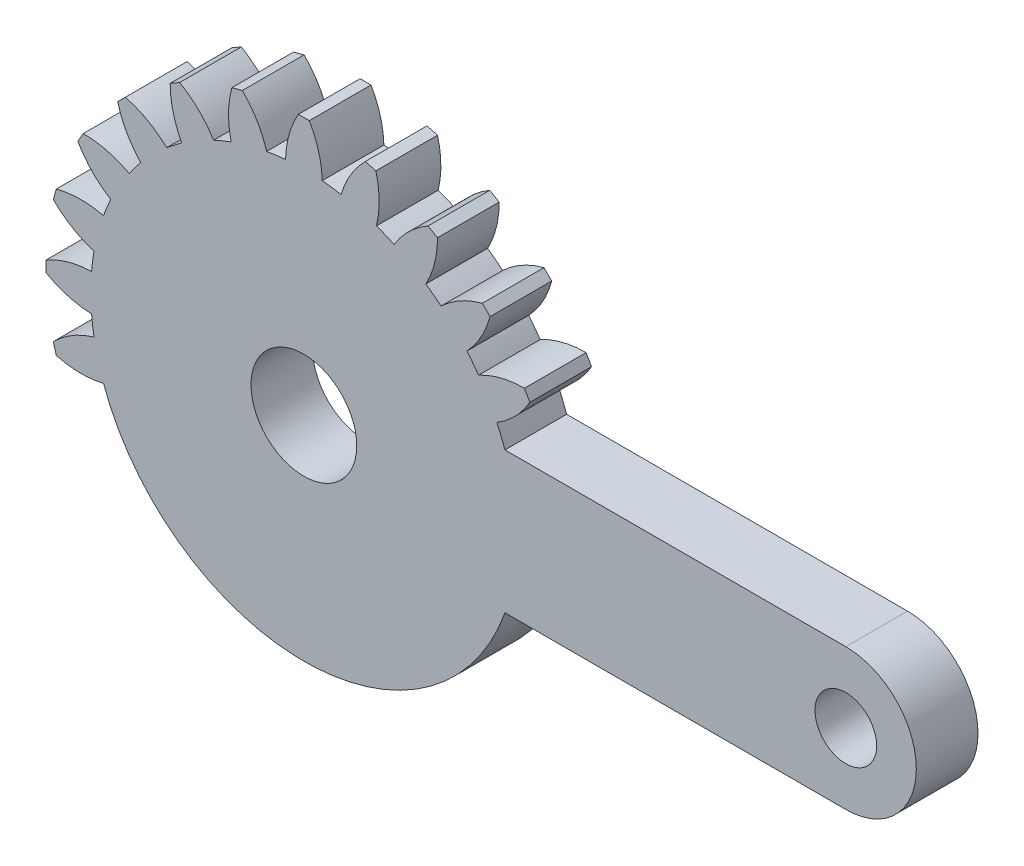
from build123d import *

# Parameters (mm, degrees)
SKETCH1_R           = 1.75
BOSS_EXTRUDE1_DEPTH = 3.5
SKETCH2_R           = 3
CUT_EXTRUDE1_DEPTH  = 38.866203929


with BuildPart() as part:
    # Sketch1 → Boss-Extrude1 (new body)
    with BuildSketch(Plane.XY):
        with BuildLine():
            Line((0.31, 14.63), (-0.31, 14.63))
            ThreePointArc((-0.31, 14.63), (-0.838273314, 13.383704325), (-1.04, 12.04518576))
            ThreePointArc((-1.04, 12.04518576), (-1.578061664, 11.986568374), (-2.112960617, 11.903927815))
            ThreePointArc((-2.112960617, 11.903927815), (-2.65424773, 13.144626757), (-3.487085624, 14.211728743))
            Line((-3.487085624, 14.211728743), (-4.085959636, 14.051260935))
            ThreePointArc((-4.085959636, 14.051260935), (-4.273667417, 12.71070456), (-4.122086336, 11.365584201))
            ThreePointArc((-4.122086336, 11.365584201), (-4.626642697, 11.169703548), (-5.12192646, 10.951436862))
            ThreePointArc((-5.12192646, 10.951436862), (-5.965886177, 12.009764599), (-7.046532125, 12.824951657))
            Line((-7.046532125, 12.824951657), (-7.583467875, 12.514951657))
            ThreePointArc((-7.583467875, 12.514951657), (-7.417818147, 11.171491285), (-6.9232593, 9.911436862))
            ThreePointArc((-6.9232593, 9.911436862), (-7.359925677, 9.591641884), (-7.781841479, 9.252623584))
            ThreePointArc((-7.781841479, 9.252623584), (-8.870959341, 10.05645683), (-10.125769107, 10.564175311))
            Line((-10.125769107, 10.564175311), (-10.564175311, 10.125769107))
            ThreePointArc((-10.564175311, 10.125769107), (-10.05645683, 8.870959341), (-9.252623584, 7.781841479))
            ThreePointArc((-9.252623584, 7.781841479), (-9.591641884, 7.359925677), (-9.911436862, 6.9232593))
            ThreePointArc((-9.911436862, 6.9232593), (-11.171491285, 7.417818147), (-12.514951657, 7.583467875))
            Line((-12.514951657, 7.583467875), (-12.824951657, 7.046532125))
            ThreePointArc((-12.824951657, 7.046532125), (-12.009764599, 5.965886177), (-10.951436862, 5.12192646))
            ThreePointArc((-10.951436862, 5.12192646), (-11.169703548, 4.626642697), (-11.365584201, 4.122086336))
            ThreePointArc((-11.365584201, 4.122086336), (-12.71070456, 4.273667417), (-14.051260935, 4.085959636))
            Line((-14.051260935, 4.085959636), (-14.211728743, 3.487085624))
            ThreePointArc((-14.211728743, 3.487085624), (-13.144626757, 2.65424773), (-11.903927815, 2.112960617))
            ThreePointArc((-11.903927815, 2.112960617), (-11.986568374, 1.578061664), (-12.04518576, 1.04))
            ThreePointArc((-12.04518576, 1.04), (-13.383704325, 0.838273314), (-14.63, 0.31))
            Line((-14.63, 0.31), (-14.63, -0.31))
            ThreePointArc((-14.63, -0.31), (-13.383704325, -0.838273314), (-12.04518576, -1.04))
            ThreePointArc((-12.04518576, -1.04), (-11.986568374, -1.578061664), (-11.903927815, -2.112960617))
            ThreePointArc((-11.903927815, -2.112960617), (-13.144626757, -2.65424773), (-14.211728743, -3.487085624))
            Line((-14.211728743, -3.487085624), (-14.051260935, -4.085959636))
            ThreePointArc((-14.051260935, -4.085959636), (-12.71070456, -4.273667417), (-11.365584201, -4.122086336))
            ThreePointArc((-11.365584201, -4.122086336), (0.064808849, -12.089826294), (11.409123542, -4))
            Line((11.409123542, -4), (30.75, -4))
            ThreePointArc((30.75, -4), (34.75, 0), (30.75, 4))
            Line((30.75, 4), (11.409123542, 4))
            ThreePointArc((11.409123542, 4), (11.194344337, 4.566700654), (10.951436862, 5.12192646))
            ThreePointArc((10.951436862, 5.12192646), (12.009764599, 5.965886177), (12.824951657, 7.046532125))
            Line((12.824951657, 7.046532125), (12.514951657, 7.583467875))
            ThreePointArc((12.514951657, 7.583467875), (11.171491285, 7.417818147), (9.911436862, 6.9232593))
            ThreePointArc((9.911436862, 6.9232593), (9.591641884, 7.359925677), (9.252623584, 7.781841479))
            ThreePointArc((9.252623584, 7.781841479), (10.05645683, 8.870959341), (10.564175311, 10.125769107))
            Line((10.564175311, 10.125769107), (10.125769107, 10.564175311))
            ThreePointArc((10.125769107, 10.564175311), (8.870959341, 10.05645683), (7.781841479, 9.252623584))
            ThreePointArc((7.781841479, 9.252623584), (7.359925677, 9.591641884), (6.9232593, 9.911436862))
            ThreePointArc((6.9232593, 9.911436862), (7.417818147, 11.171491285), (7.583467875, 12.514951657))
            Line((7.583467875, 12.514951657), (7.046532125, 12.824951657))
            ThreePointArc((7.046532125, 12.824951657), (5.965886177, 12.009764599), (5.12192646, 10.951436862))
            ThreePointArc((5.12192646, 10.951436862), (4.626642697, 11.169703548), (4.122086336, 11.365584201))
            ThreePointArc((4.122086336, 11.365584201), (4.273667417, 12.71070456), (4.085959636, 14.051260935))
            Line((4.085959636, 14.051260935), (3.487085624, 14.211728743))
            ThreePointArc((3.487085624, 14.211728743), (2.65424773, 13.144626757), (2.112960617, 11.903927815))
            ThreePointArc((2.112960617, 11.903927815), (1.578061664, 11.986568374), (1.04, 12.04518576))
            ThreePointArc((1.04, 12.04518576), (0.838273314, 13.383704325), (0.31, 14.63))
        make_face()
        with Locations((30.75, 0)):
            Circle(SKETCH1_R, mode=Mode.SUBTRACT)
        Circle(SKETCH1_R, mode=Mode.SUBTRACT)
    extrude(amount=BOSS_EXTRUDE1_DEPTH)

    # Sketch2 → Cut-Extrude1 (cut, through all)
    with BuildSketch(Plane.XY.offset(3.5)):
        Circle(SKETCH2_R)
    extrude(amount=-CUT_EXTRUDE1_DEPTH, mode=Mode.SUBTRACT)


solid = part.part
